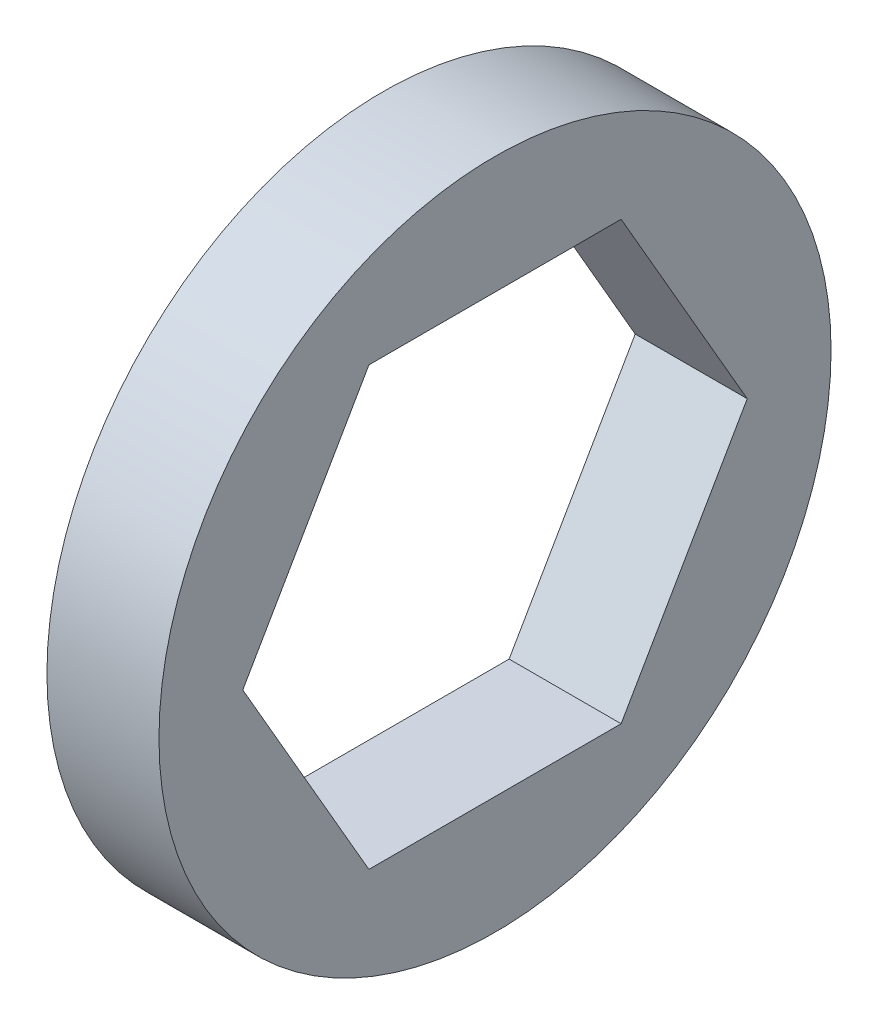
from build123d import *

# Parameters (mm, degrees)
SKETCH1_R           = 7.62
BOSS_EXTRUDE1_DEPTH = 2.54


with BuildPart() as part:
    # Sketch1 → Boss-Extrude1 (new body)
    with BuildSketch(Plane(origin=(0, 0, 0), x_dir=(0, 0, -1), z_dir=(1, 0, 0))):
        Circle(SKETCH1_R)
        Polygon((5.719231767, 0), (2.859615883, 4.953), (-2.859615883, 4.953), (-5.719231767, 0), (-2.859615883, -4.953), (2.859615883, -4.953), align=None, mode=Mode.SUBTRACT)
    extrude(amount=BOSS_EXTRUDE1_DEPTH)


solid = part.part
